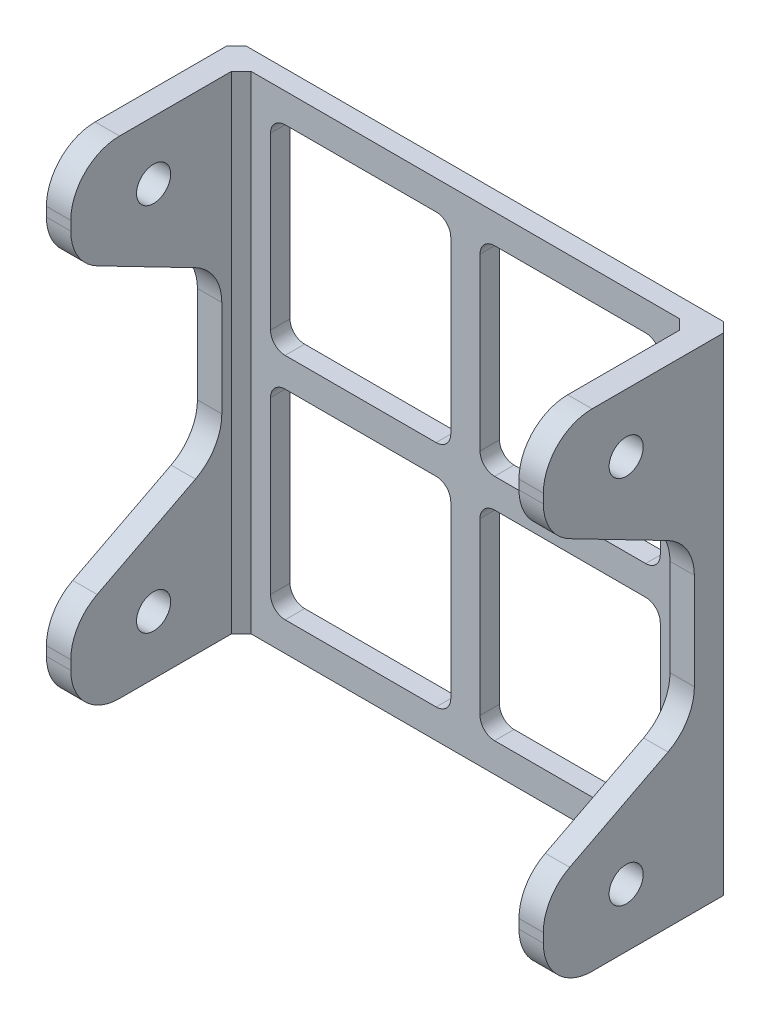
from build123d import *

# Parameters (mm, degrees)
ESQUISSE1_W                  = 102
ESQUISSE1_H                  = 100
BOSS_EXTRU_1_DEPTH           = 4
ESQUISSE2_W                  = 5
ESQUISSE2_H                  = 100
BOSS_EXTRU_2_DEPTH           = 35
ENL_V_MAT_EXTRU_1_DEPTH      = 149.07092895
ENL_V_MAT_EXTRU_1_DEPTH_BACK = 149.07092895
ESQUISSE3_R                  = 3.5
ENL_V_MAT_EXTRU_2_DEPTH      = 149.07092895
ENL_V_MAT_EXTRU_2_DEPTH_BACK = 149.07092895
CONG_1_R                     = 10
ENL_V_MAT_EXTRU_3_DEPTH      = 148.068011478
ENL_V_MAT_EXTRU_3_DEPTH_BACK = 148.068011478
ESQUISSE5_W                  = 37
ESQUISSE5_H                  = 41
CONG_2_R                     = 3
CHANFREIN1_SIZE              = 2


with BuildPart() as part:
    # Esquisse1 → Boss.-Extru.1 (new body)
    with BuildSketch(Plane.XY):
        with Locations((51, 50)):
            Rectangle(ESQUISSE1_W, ESQUISSE1_H)
    extrude(amount=BOSS_EXTRU_1_DEPTH)

    # Esquisse2 → Boss.-Extru.2 (add)
    with BuildSketch(Plane.XY.offset(4)):
        with Locations((2.5, 50)):
            Rectangle(ESQUISSE2_W, ESQUISSE2_H)
        with Locations((99.5, 50)):
            Rectangle(ESQUISSE2_W, ESQUISSE2_H)
    extrude(amount=BOSS_EXTRU_2_DEPTH)

    # Esquisse3 → Enlèv. mat.-Extru.1 (cut, two sides: drawn at the far end of the back side and taken through both)
    with BuildSketch(Plane.ZY.offset(-ENL_V_MAT_EXTRU_1_DEPTH_BACK)):
        with Locations(Location((22, 12, 0), (0, 0, 270))):
            Circle(ESQUISSE3_R)
        with Locations(Location((22, 88, 0), (0, 0, 270))):
            Circle(ESQUISSE3_R)
    extrude(amount=ENL_V_MAT_EXTRU_1_DEPTH + ENL_V_MAT_EXTRU_1_DEPTH_BACK, mode=Mode.SUBTRACT)

    # Esquisse4 → Enlèv. mat.-Extru.2 (cut, two sides: drawn at the far end of the back side and taken through both)
    with BuildSketch(Plane.ZY.offset(-ENL_V_MAT_EXTRU_2_DEPTH_BACK)):
        Polygon((39, 82), (8, 66), (8, 34), (39, 18), align=None)
    extrude(amount=ENL_V_MAT_EXTRU_2_DEPTH + ENL_V_MAT_EXTRU_2_DEPTH_BACK, mode=Mode.SUBTRACT)

    # Congé1
    cong_1_edges = [part.edges().sort_by_distance(p)[0] for p in [
        (99.5, 100, 39),
        (99.5, 0, 39),
        (2.5, 0, 39),
        (2.5, 100, 39),
        (2.5, 82, 39),
        (2.5, 18, 39),
        (99.5, 82, 39),
        (2.5, 34, 8),
        (99.5, 34, 8),
        (99.5, 18, 39),
        (2.5, 66, 8),
        (99.5, 66, 8),
    ]]
    fillet(cong_1_edges, radius=CONG_1_R)

    # Esquisse5 → Enlèv. mat.-Extru.3 (cut, two sides: drawn at the far end of the back side and taken through both)
    with BuildSketch(Plane.XY.offset(4).offset(-ENL_V_MAT_EXTRU_3_DEPTH_BACK)):
        with Locations((29.5, 73.5)):
            Rectangle(ESQUISSE5_W, ESQUISSE5_H)
        with Locations((29.5, 26.5)):
            Rectangle(ESQUISSE5_W, ESQUISSE5_H)
        with Locations((72.5, 26.5)):
            Rectangle(ESQUISSE5_W, ESQUISSE5_H)
        with Locations((72.5, 73.5)):
            Rectangle(ESQUISSE5_W, ESQUISSE5_H)
    extrude(amount=ENL_V_MAT_EXTRU_3_DEPTH + ENL_V_MAT_EXTRU_3_DEPTH_BACK, mode=Mode.SUBTRACT)

    # Congé2
    cong_2_edges = [part.edges().sort_by_distance(p)[0] for p in [
        (54, 94, 2),
        (91, 94, 2),
        (91, 53, 2),
        (54, 53, 2),
        (91, 47, 2),
        (91, 6, 2),
        (54, 6, 2),
        (54, 47, 2),
        (48, 6, 2),
        (11, 6, 2),
        (11, 47, 2),
        (48, 47, 2),
        (11, 53, 2),
        (11, 94, 2),
        (48, 94, 2),
        (48, 53, 2),
    ]]
    fillet(cong_2_edges, radius=CONG_2_R)

    # Chanfrein1
    chanfrein1_edges = [part.edges().sort_by_distance(p)[0] for p in [
        (97, 50, 4),
        (5, 50, 4),
        (102, 50, 0),
        (0, 50, 0),
    ]]
    chamfer(chanfrein1_edges, length=CHANFREIN1_SIZE)


solid = part.part
